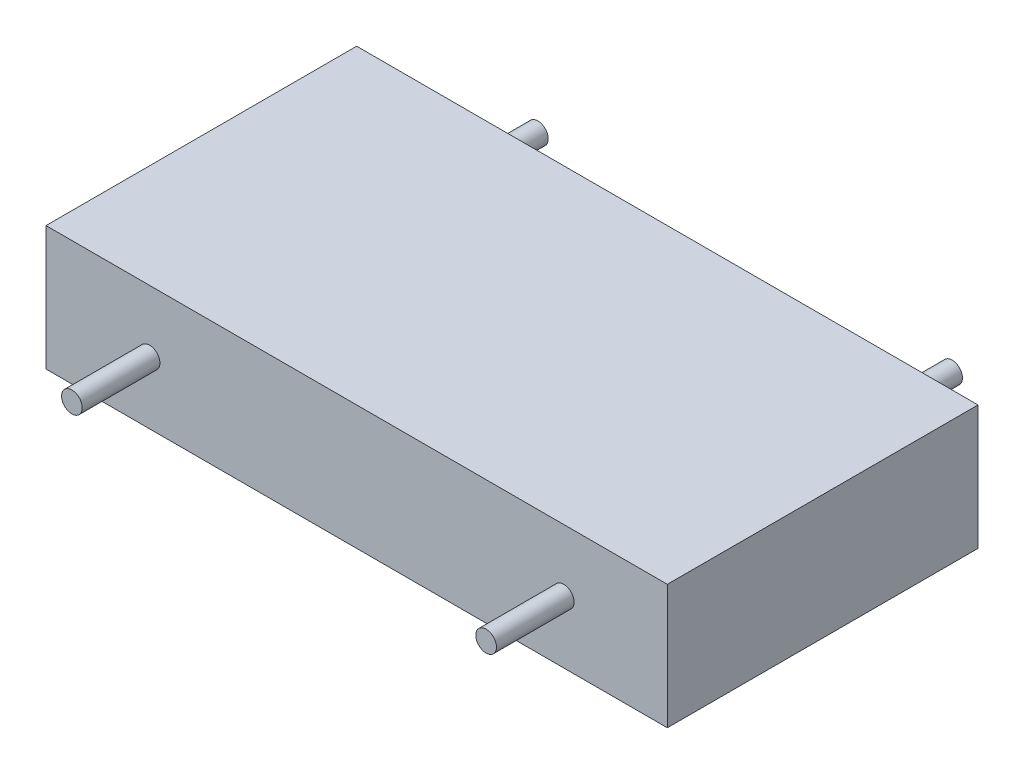
from build123d import *

# Parameters (mm, degrees)
SKETCH1_W           = 600
SKETCH1_H           = 300
BOSS_EXTRUDE1_DEPTH = 120
SKETCH3_R           = 10
BOSS_EXTRUDE3_DEPTH = 75
BOSS_EXTRUDE4_START = 75
SKETCH2_R           = 10
BOSS_EXTRUDE4_DEPTH = 75


with BuildPart() as part:
    # Sketch1 → Boss-Extrude1 (new body)
    with BuildSketch(Plane(origin=(0, 0, 0), x_dir=(1, 0, 0), z_dir=(0, 1, 0))):
        Rectangle(SKETCH1_W, SKETCH1_H)
    extrude(amount=BOSS_EXTRUDE1_DEPTH)

    # Sketch3 → Boss-Extrude3 (add)
    with BuildSketch(Plane.XY.offset(150)):
        with Locations(Location((-200, 60, 0), (0, 0, 180))):
            Circle(SKETCH3_R)
        with Locations(Location((200, 60, 0), (0, 0, 180))):
            Circle(SKETCH3_R)
    extrude(amount=BOSS_EXTRUDE3_DEPTH)

    # Sketch2 → Boss-Extrude4 (add)
    with BuildSketch(Plane(origin=(0, 0, -150), x_dir=(-1, 0, 0), z_dir=(0, 0, -1)).offset(BOSS_EXTRUDE4_START)):
        with Locations((-200, 60)):
            Circle(SKETCH2_R)
        with Locations((200, 60)):
            Circle(SKETCH2_R)
    extrude(amount=-BOSS_EXTRUDE4_DEPTH)


solid = part.part
